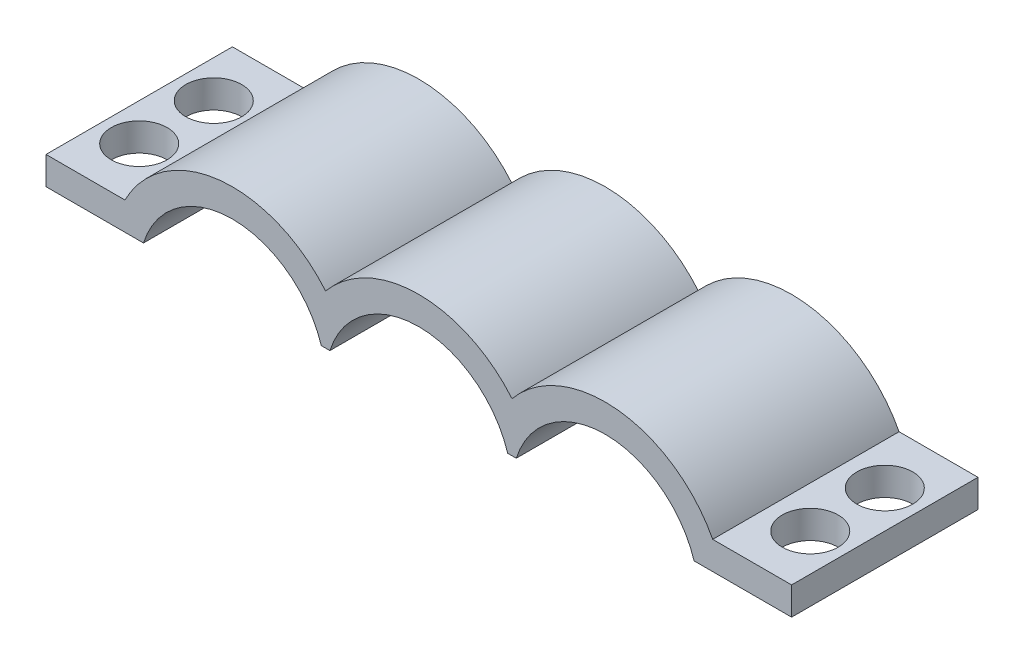
from build123d import *

# Parameters (mm, degrees)
EXTRUDE_1_DEPTH     = 10
SKETCH_2_R          = 1.5
CUT_EXTRUDE_1_DEPTH = 10


with BuildPart() as part:
    # 草图1 → 凸台-拉伸1 (new body)
    with BuildSketch(Plane.XY):
        with BuildLine():
            Line((-20, 1.5), (-20, 3))
            Line((-20, 3), (-15.766281297, 3))
            ThreePointArc((-15.766281297, 3), (-10.6923358, 6.463023375), (-5, 4.153311931))
            ThreePointArc((-5, 4.153311931), (0, 6.5), (5, 4.153311931))
            ThreePointArc((5, 4.153311931), (10.6923358, 6.463023375), (15.766281297, 3))
            Line((15.766281297, 3), (20, 3))
            Line((20, 3), (20, 1.5))
            Line((20, 1.5), (14.769696007, 1.5))
            ThreePointArc((14.769696007, 1.5), (10, 5), (5.230303993, 1.5))
            Line((5.230303993, 1.5), (4.769696007, 1.5))
            ThreePointArc((4.769696007, 1.5), (0, 5), (-4.769696007, 1.5))
            Line((-4.769696007, 1.5), (-5.230303993, 1.5))
            ThreePointArc((-5.230303993, 1.5), (-10, 5), (-14.769696007, 1.5))
            Line((-14.769696007, 1.5), (-20, 1.5))
        make_face()
    extrude(amount=EXTRUDE_1_DEPTH)

    # 草图2 → 切除-拉伸1 (cut)
    with BuildSketch(Plane(origin=(0, 3, 0), x_dir=(1, 0, 0), z_dir=(0, 1, 0))):
        with Locations(Location((-18, -3, 0), (0, 0, 270))):
            Circle(SKETCH_2_R)
        with Locations(Location((-18, -7, 0), (0, 0, 180))):
            Circle(SKETCH_2_R)
        with Locations(Location((18, -7, 0), (0, 0, 270))):
            Circle(SKETCH_2_R)
        with Locations(Location((18, -3, 0), (0, 0, 180))):
            Circle(SKETCH_2_R)
    extrude(amount=-CUT_EXTRUDE_1_DEPTH, mode=Mode.SUBTRACT)


solid = part.part
